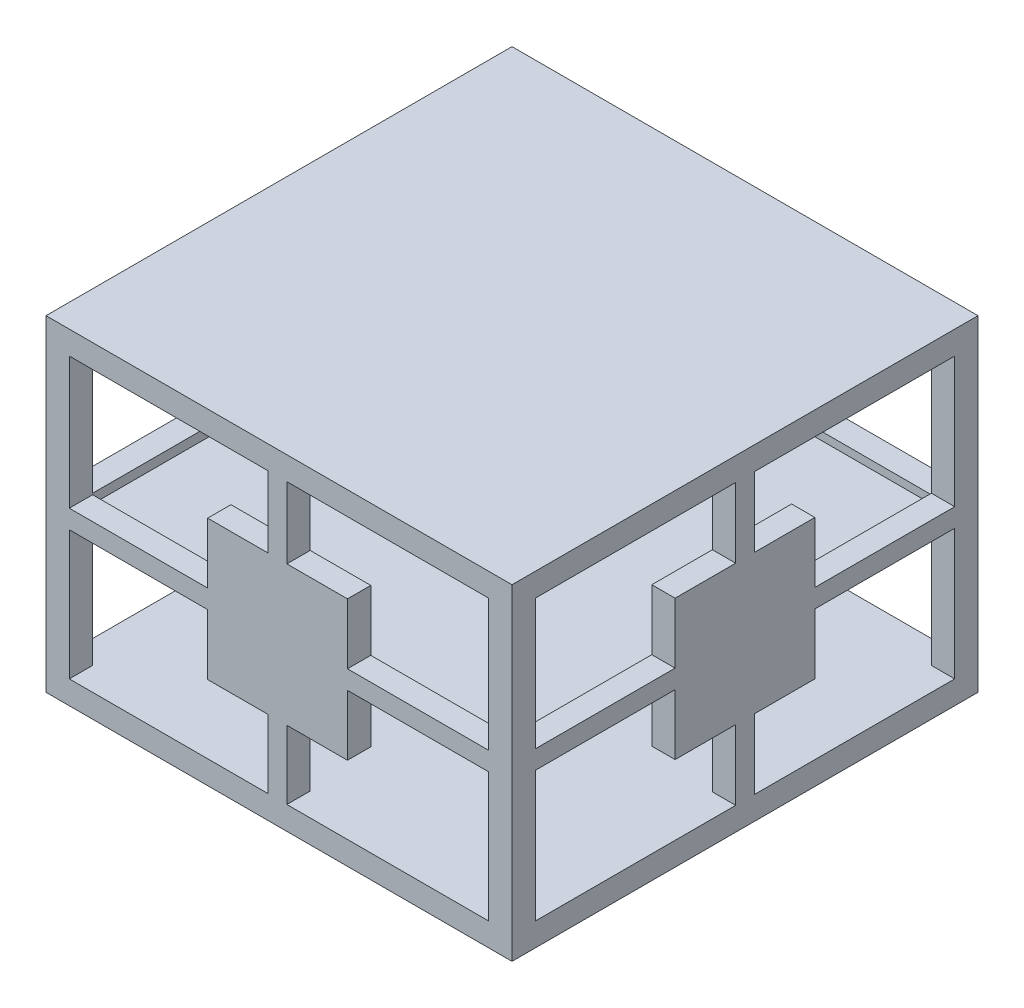
from build123d import *

# Parameters (mm, degrees)
SKETCH1_W           = 200
SKETCH1_H           = 200
BOSS_EXTRUDE1_DEPTH = 140
SHELL2_T            = 10
CUT_EXTRUDE2_DEPTH  = 264.818119165
CUT_EXTRUDE3_DEPTH  = 264.818119165
SKETCH4_W           = 180
SKETCH4_H           = 180
BOSS_EXTRUDE3_DEPTH = 4


with BuildPart() as part:
    # Sketch1 → Boss-Extrude1 (new body)
    with BuildSketch(Plane(origin=(0, 0, 0), x_dir=(1, 0, 0), z_dir=(0, 1, 0))):
        Rectangle(SKETCH1_W, SKETCH1_H)
    extrude(amount=BOSS_EXTRUDE1_DEPTH)

    # Shell2 (no face opened: a closed hollow body)
    add(offset(amount=-SHELL2_T, mode=Mode.PRIVATE), mode=Mode.SUBTRACT)

    # Sketch2 → Cut-Extrude2 (cut, through all)
    with BuildSketch(Plane(origin=(100, 0, 0), x_dir=(0, 0, -1), z_dir=(1, 0, 0))):
        Polygon((-30, 40), (-4, 40), (-4, 10), (-90, 10), (-90, 66), (-30, 66), align=None)
        Polygon((-30, 100), (-4, 100), (-4, 130), (-90, 130), (-90, 74), (-30, 74), align=None)
        Polygon((30, 40), (30, 66), (90, 66), (90, 10), (4, 10), (4, 40), align=None)
        Polygon((30, 74), (30, 100), (4, 100), (4, 130), (90, 130), (90, 74), align=None)
    extrude(amount=-CUT_EXTRUDE2_DEPTH, mode=Mode.SUBTRACT)

    # Sketch3 → Cut-Extrude3 (cut, through all)
    with BuildSketch(Plane.XY.offset(100)):
        Polygon((3.383720977, 39.438488697), (3.383720977, 10), (90, 10), (90, 65.438488697), (29.383720977, 65.438488697), (29.383720977, 39.438488697), align=None)
        Polygon((3.383720977, 130), (90, 130), (90, 73.438488697), (29.383720977, 73.438488697), (29.383720977, 99.438488697), (3.383720977, 99.438488697), align=None)
        Polygon((-90, 130), (-4.616279023, 130), (-4.616279023, 99.438488697), (-30.616279023, 99.438488697), (-30.616279023, 73.438488697), (-90, 73.438488697), align=None)
        Polygon((-30.616279023, 65.438488697), (-90, 65.438488697), (-90, 10), (-4.616279023, 10), (-4.616279023, 39.438488697), (-30.616279023, 39.438488697), align=None)
    extrude(amount=-CUT_EXTRUDE3_DEPTH, mode=Mode.SUBTRACT)

    # Sketch4 → Boss-Extrude3 (add)
    with BuildSketch(Plane(origin=(29.307172117, 70, -14.72040922), x_dir=(1, 0, 0), z_dir=(0, 1, 0))):
        with Locations((-29.307172117, -14.72040922)):
            Rectangle(SKETCH4_W, SKETCH4_H)
    extrude(amount=-BOSS_EXTRUDE3_DEPTH)


solid = part.part
